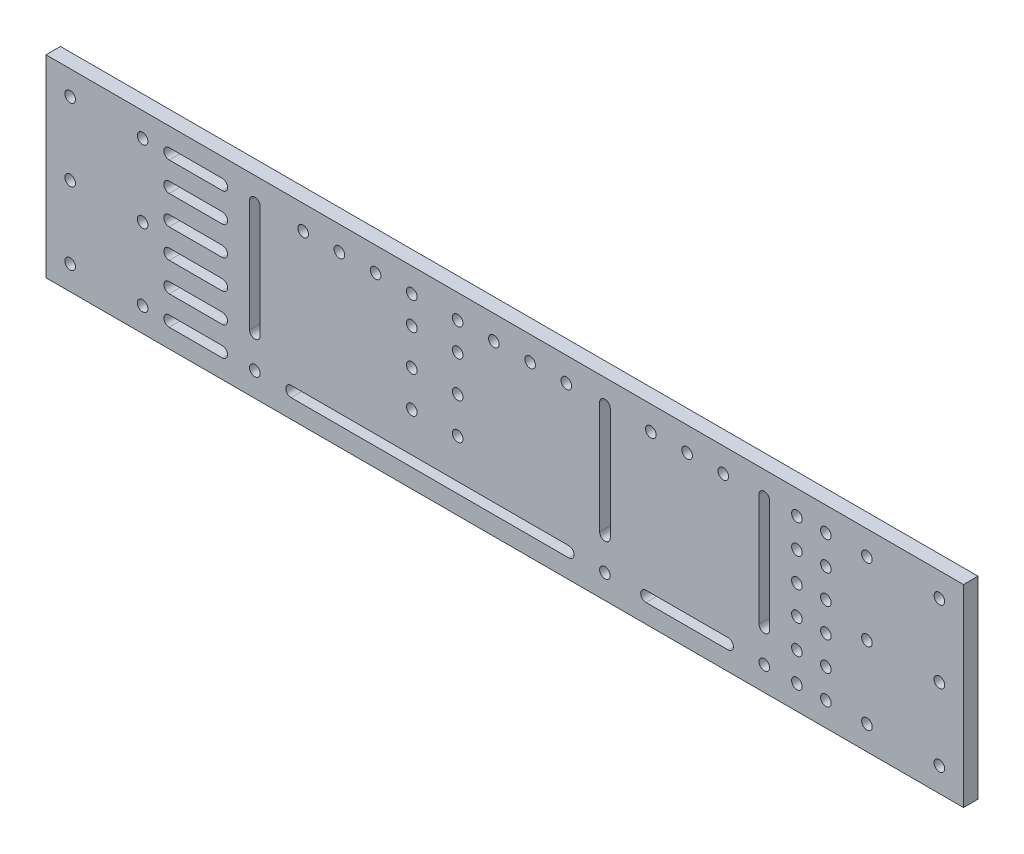
from build123d import *

# Parameters (mm, degrees)
SKETCH1_W           = 380
SKETCH1_H           = 80
SKETCH1_R           = 2.2
BOSS_EXTRUDE1_DEPTH = 6


with BuildPart() as part:
    # Sketch1 → Boss-Extrude1 (new body)
    with BuildSketch(Plane(origin=(0, 0, -15.5), x_dir=(-1, 0, 0), z_dir=(0, 0, -1))):
        with Locations((141, 0)):
            Rectangle(SKETCH1_W, SKETCH1_H)
        with Locations(Location((-9, -30, 0), (0, 0, 180))):
            Circle(SKETCH1_R, mode=Mode.SUBTRACT)
        with Locations(Location((-9, 30, 0), (0, 0, 180))):
            Circle(SKETCH1_R, mode=Mode.SUBTRACT)
        with Locations(Location((-9, 0, 0), (0, 0, 180))):
            Circle(SKETCH1_R, mode=Mode.SUBTRACT)
        with Locations(Location((-39, -30, 0), (0, 0, 180))):
            Circle(SKETCH1_R, mode=Mode.SUBTRACT)
        with Locations(Location((-39, 30, 0), (0, 0, 180))):
            Circle(SKETCH1_R, mode=Mode.SUBTRACT)
        with Locations(Location((-39, 0, 0), (0, 0, 180))):
            Circle(SKETCH1_R, mode=Mode.SUBTRACT)
        with Locations(Location((291, 30, 0), (0, 0, 180))):
            Circle(SKETCH1_R, mode=Mode.SUBTRACT)
        with Locations(Location((321, -30, 0), (0, 0, 180))):
            Circle(SKETCH1_R, mode=Mode.SUBTRACT)
        with Locations(Location((321, 0, 0), (0, 0, 180))):
            Circle(SKETCH1_R, mode=Mode.SUBTRACT)
        with Locations(Location((33.5, -30, 0), (0, 0, 180))):
            Circle(SKETCH1_R, mode=Mode.SUBTRACT)
        with Locations(Location((65.5, 30, 0), (0, 0, 180))):
            Circle(SKETCH1_R, mode=Mode.SUBTRACT)
        with Locations(Location((99.5, -30, 0), (0, 0, 180))):
            Circle(SKETCH1_R, mode=Mode.SUBTRACT)
        with Locations(Location((115.5, 30, 0), (0, 0, 180))):
            Circle(SKETCH1_R, mode=Mode.SUBTRACT)
        with Locations(Location((160.5, -11.5, 0), (0, 0, 180))):
            Circle(SKETCH1_R, mode=Mode.SUBTRACT)
        with Locations(Location((160.5, 18.5, 0), (0, 0, 180))):
            Circle(SKETCH1_R, mode=Mode.SUBTRACT)
        with Locations(Location((179.5, -11.5, 0), (0, 0, 180))):
            Circle(SKETCH1_R, mode=Mode.SUBTRACT)
        with Locations(Location((179.5, 18.5, 0), (0, 0, 180))):
            Circle(SKETCH1_R, mode=Mode.SUBTRACT)
        with Locations(Location((194.5, 30, 0), (0, 0, 180))):
            Circle(SKETCH1_R, mode=Mode.SUBTRACT)
        with Locations(Location((224.5, 30, 0), (0, 0, 180))):
            Circle(SKETCH1_R, mode=Mode.SUBTRACT)
        with Locations(Location((8, 6, 0), (0, 0, 180))):
            Circle(SKETCH1_R, mode=Mode.SUBTRACT)
        with Locations(Location((20, -30, 0), (0, 0, 180))):
            Circle(SKETCH1_R, mode=Mode.SUBTRACT)
        with Locations(Location((8, -18, 0), (0, 0, 180))):
            Circle(SKETCH1_R, mode=Mode.SUBTRACT)
        with Locations(Location((20, 18, 0), (0, 0, 180))):
            Circle(SKETCH1_R, mode=Mode.SUBTRACT)
        with Locations(Location((8, 30, 0), (0, 0, 180))):
            Circle(SKETCH1_R, mode=Mode.SUBTRACT)
        with Locations(Location((20, -6, 0), (0, 0, 180))):
            Circle(SKETCH1_R, mode=Mode.SUBTRACT)
        with Locations(Location((8, -6, 0), (0, 0, 180))):
            Circle(SKETCH1_R, mode=Mode.SUBTRACT)
        with Locations(Location((20, 6, 0), (0, 0, 180))):
            Circle(SKETCH1_R, mode=Mode.SUBTRACT)
        with Locations(Location((8, 18, 0), (0, 0, 180))):
            Circle(SKETCH1_R, mode=Mode.SUBTRACT)
        with Locations(Location((20, 30, 0), (0, 0, 180))):
            Circle(SKETCH1_R, mode=Mode.SUBTRACT)
        with Locations(Location((8, -30, 0), (0, 0, 180))):
            Circle(SKETCH1_R, mode=Mode.SUBTRACT)
        with Locations(Location((20, -18, 0), (0, 0, 180))):
            Circle(SKETCH1_R, mode=Mode.SUBTRACT)
        with Locations(Location((244.5, -30, 0), (0, 0, 180))):
            Circle(SKETCH1_R, mode=Mode.SUBTRACT)
        with Locations(Location((209.5, 30, 0), (0, 0, 180))):
            Circle(SKETCH1_R, mode=Mode.SUBTRACT)
        with Locations(Location((179.5, 30, 0), (0, 0, 180))):
            Circle(SKETCH1_R, mode=Mode.SUBTRACT)
        with Locations(Location((179.5, 3.5, 0), (0, 0, 180))):
            Circle(SKETCH1_R, mode=Mode.SUBTRACT)
        with Locations(Location((160.5, 30, 0), (0, 0, 180))):
            Circle(SKETCH1_R, mode=Mode.SUBTRACT)
        with Locations(Location((160.5, 3.5, 0), (0, 0, 180))):
            Circle(SKETCH1_R, mode=Mode.SUBTRACT)
        with Locations(Location((130.5, 30, 0), (0, 0, 180))):
            Circle(SKETCH1_R, mode=Mode.SUBTRACT)
        with Locations(Location((145.5, 30, 0), (0, 0, 180))):
            Circle(SKETCH1_R, mode=Mode.SUBTRACT)
        with Locations(Location((80.5, 30, 0), (0, 0, 180))):
            Circle(SKETCH1_R, mode=Mode.SUBTRACT)
        with Locations(Location((50.5, 30, 0), (0, 0, 180))):
            Circle(SKETCH1_R, mode=Mode.SUBTRACT)
        with Locations(Location((321, 30, 0), (0, 0, 180))):
            Circle(SKETCH1_R, mode=Mode.SUBTRACT)
        with Locations(Location((291, 0, 0), (0, 0, 180))):
            Circle(SKETCH1_R, mode=Mode.SUBTRACT)
        with Locations(Location((291, -30, 0), (0, 0, 180))):
            Circle(SKETCH1_R, mode=Mode.SUBTRACT)
        with BuildLine():
            Line((280, 15.8), (258, 15.8))
            ThreePointArc((258, 15.8), (255.8, 18), (258, 20.2))
            Line((258, 20.2), (280, 20.2))
            ThreePointArc((280, 20.2), (282.2, 18), (280, 15.8))
        make_face(mode=Mode.SUBTRACT)
        with BuildLine():
            Line((280, -8.2), (258, -8.2))
            ThreePointArc((258, -8.2), (255.8, -6), (258, -3.8))
            Line((258, -3.8), (280, -3.8))
            ThreePointArc((280, -3.8), (282.2, -6), (280, -8.2))
        make_face(mode=Mode.SUBTRACT)
        with BuildLine():
            Line((280, -32.2), (258, -32.2))
            ThreePointArc((258, -32.2), (255.8, -30), (258, -27.8))
            Line((258, -27.8), (280, -27.8))
            ThreePointArc((280, -27.8), (282.2, -30), (280, -32.2))
        make_face(mode=Mode.SUBTRACT)
        with BuildLine():
            Line((280, -20.2), (258, -20.2))
            ThreePointArc((258, -20.2), (255.8, -18), (258, -15.8))
            Line((258, -15.8), (280, -15.8))
            ThreePointArc((280, -15.8), (282.2, -18), (280, -20.2))
        make_face(mode=Mode.SUBTRACT)
        with BuildLine():
            Line((280, 3.8), (258, 3.8))
            ThreePointArc((258, 3.8), (255.8, 6), (258, 8.2))
            Line((258, 8.2), (280, 8.2))
            ThreePointArc((280, 8.2), (282.2, 6), (280, 3.8))
        make_face(mode=Mode.SUBTRACT)
        with BuildLine():
            Line((280, 27.8), (258, 27.8))
            ThreePointArc((258, 27.8), (255.8, 30), (258, 32.2))
            Line((258, 32.2), (280, 32.2))
            ThreePointArc((280, 32.2), (282.2, 30), (280, 27.8))
        make_face(mode=Mode.SUBTRACT)
        with BuildLine():
            Line((31.3, -16.5), (31.3, 30))
            ThreePointArc((31.3, 30), (33.5, 32.2), (35.7, 30))
            Line((35.7, 30), (35.7, -16.5))
            ThreePointArc((35.7, -16.5), (33.5, -18.7), (31.3, -16.5))
        make_face(mode=Mode.SUBTRACT)
        with BuildLine():
            Line((48.5, -27.8), (82.5, -27.8))
            ThreePointArc((82.5, -27.8), (84.7, -30), (82.5, -32.2))
            Line((82.5, -32.2), (48.5, -32.2))
            ThreePointArc((48.5, -32.2), (46.3, -30), (48.5, -27.8))
        make_face(mode=Mode.SUBTRACT)
        with BuildLine():
            Line((97.3, -16.5), (97.3, 30))
            ThreePointArc((97.3, 30), (99.5, 32.2), (101.7, 30))
            Line((101.7, 30), (101.7, -16.5))
            ThreePointArc((101.7, -16.5), (99.5, -18.7), (97.3, -16.5))
        make_face(mode=Mode.SUBTRACT)
        with BuildLine():
            Line((242.3, -16.5), (242.3, 30))
            ThreePointArc((242.3, 30), (244.5, 32.2), (246.7, 30))
            Line((246.7, 30), (246.7, -16.5))
            ThreePointArc((246.7, -16.5), (244.5, -18.7), (242.3, -16.5))
        make_face(mode=Mode.SUBTRACT)
        with BuildLine():
            Line((229.5, -32.2), (114.5, -32.2))
            ThreePointArc((114.5, -32.2), (112.3, -30), (114.5, -27.8))
            Line((114.5, -27.8), (229.5, -27.8))
            ThreePointArc((229.5, -27.8), (231.7, -30), (229.5, -32.2))
        make_face(mode=Mode.SUBTRACT)
    extrude(amount=-BOSS_EXTRUDE1_DEPTH)


solid = part.part
